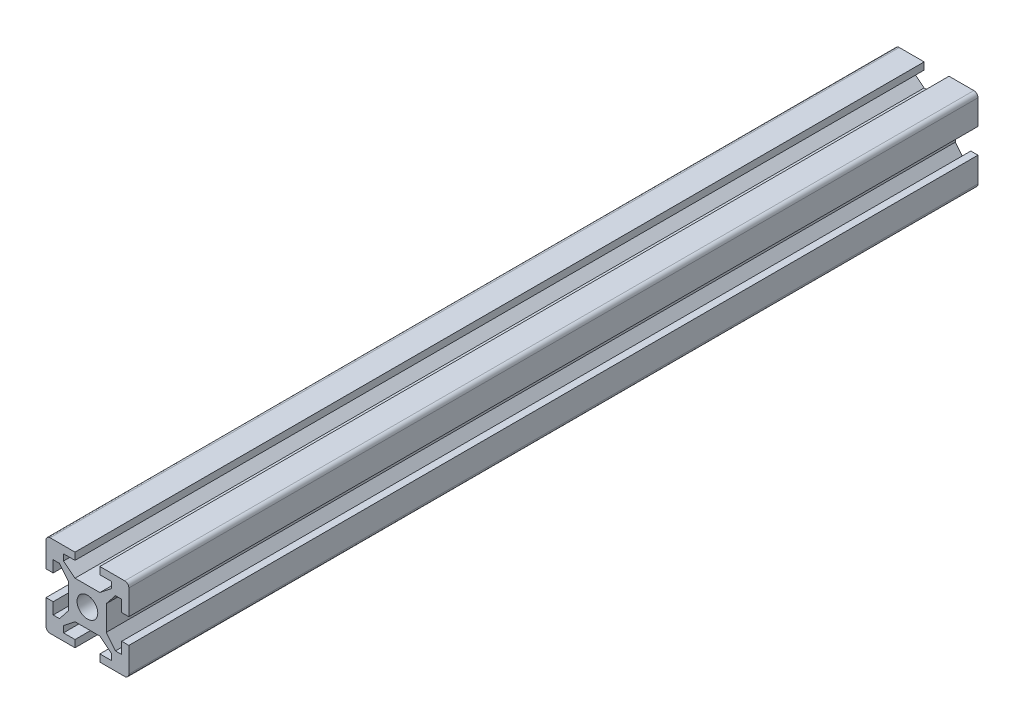
from build123d import *

# Parameters (mm, degrees)
BOSS_EXTRUDE1_DEPTH     = 102.5
CUT_EXTRUDE1_DEPTH      = 206.48722588
CUT_EXTRUDE1_DEPTH_BACK = 206.48722588
SKETCH2_R               = 2.5
FILLET1_R               = 1


with BuildPart() as part:
    # Sketch1 → Boss-Extrude1 (new, symmetric)
    with BuildSketch(Plane.XY):
        Polygon((-10, 10), (-3, 10), (-3, 8.272610059), (-5.783778863, 8.272610059), (-5.783778863, 6.747994248), (-3, 4.550753814), (3, 4.550753814), (5.783778863, 6.747994248), (5.783778863, 8.272610059), (3, 8.272610059), (3, 10), (10, 10), (10, 3), (8.272610059, 3), (8.272610059, 5.783778863), (6.747994248, 5.783778863), (4.55, 3.000595152), (4.55, -2.999404848), (6.747994248, -5.783778863), (8.272610059, -5.783778863), (8.272610059, -3), (10, -3), (10, -10), (3, -10), (3, -8.272610059), (5.783778863, -8.272610059), (5.783778863, -6.747994248), (2.999404848, -4.55), (-3.000595152, -4.55), (-5.783778863, -6.747994248), (-5.783778863, -8.272610059), (-3, -8.272610059), (-3, -10), (-10, -10), (-10, -3), (-8.272610059, -3), (-8.272610059, -5.783778863), (-6.747994248, -5.783778863), (-4.55, -3.000595152), (-4.55, 2.999404848), (-6.747994248, 5.783778863), (-8.272610059, 5.783778863), (-8.272610059, 3), (-10, 3), align=None)
    extrude(amount=BOSS_EXTRUDE1_DEPTH, both=True)

    # Sketch2 → Cut-Extrude1 (cut, two sides: drawn at the far end of the back side and taken through both)
    with BuildSketch(Plane.XY.offset(102.5).offset(-CUT_EXTRUDE1_DEPTH_BACK)):
        Circle(SKETCH2_R)
    extrude(amount=CUT_EXTRUDE1_DEPTH + CUT_EXTRUDE1_DEPTH_BACK, mode=Mode.SUBTRACT)

    # Fillet1
    fillet1_edges = [part.edges().sort_by_distance(p)[0] for p in [
        (-10, 10, 0),
        (10, 10, 0),
        (10, -10, 0),
        (-10, -10, 0),
    ]]
    fillet(fillet1_edges, radius=FILLET1_R)


solid = part.part
